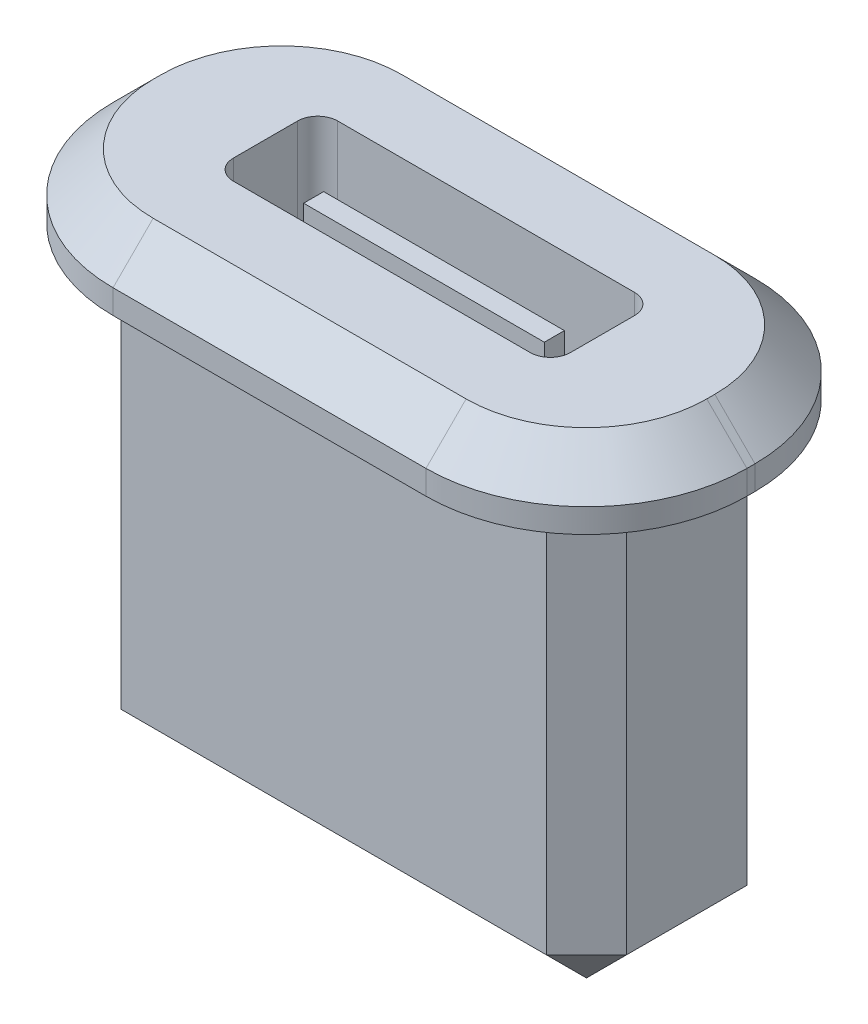
from build123d import *

# Parameters (mm, degrees)
BOSS_EXTRUDE1_DEPTH = 1.6
CHAMFER1_SIZE       = 1
SKETCH3_W           = 12.6
SKETCH3_H           = 5
BOSS_EXTRUDE2_DEPTH = 11
CHAMFER2_SIZE       = 1
CUT_EXTRUDE1_DEPTH  = 6.65
SKETCH4_W           = 6
SKETCH4_H           = 0.5
BOSS_EXTRUDE3_DEPTH = 6


with BuildPart() as part:
    # Sketch1 → Boss-Extrude1 (new body)
    with BuildSketch(Plane(origin=(0, 0, 0), x_dir=(1, 0, 0), z_dir=(0, 1, 0))):
        with BuildLine():
            Line((-3.9, -4.1), (3.9, -4.1))
            ThreePointArc((3.9, -4.1), (6.728427125, -2.928427125), (7.9, -0.1))
            Line((7.9, -0.1), (7.9, 0.1))
            ThreePointArc((7.9, 0.1), (6.728427125, 2.928427125), (3.9, 4.1))
            Line((3.9, 4.1), (-3.9, 4.1))
            ThreePointArc((-3.9, 4.1), (-6.728427125, 2.928427125), (-7.9, 0.1))
            Line((-7.9, 0.1), (-7.9, -0.1))
            ThreePointArc((-7.9, -0.1), (-6.728427125, -2.928427125), (-3.9, -4.1))
        make_face()
    extrude(amount=BOSS_EXTRUDE1_DEPTH)

    # Chamfer1
    chamfer1_edges = [part.edges().sort_by_distance(p)[0] for p in [
        (0, 1.6, -4.1),
        (-6.728427125, 1.6, -2.928427125),
        (6.728427125, 1.6, -2.928427125),
        (-7.9, 1.6, 0),
        (7.9, 1.6, 0),
        (-6.728427125, 1.6, 2.928427125),
        (6.728427125, 1.6, 2.928427125),
        (0, 1.6, 4.1),
    ]]
    chamfer(chamfer1_edges, length=CHAMFER1_SIZE)

    # Sketch3 → Boss-Extrude2 (add)
    with BuildSketch(Plane.XZ):
        Rectangle(SKETCH3_W, SKETCH3_H)
    extrude(amount=BOSS_EXTRUDE2_DEPTH)

    # Chamfer2
    chamfer2_edges = [part.edges().sort_by_distance(p)[0] for p in [
        (-6.3, -11, 0),
        (-6.3, -5.5, 2.5),
        (6.3, -5.5, 2.5),
        (0, -11, 2.5),
        (6.3, -11, 0),
        (6.3, -5.5, -2.5),
        (0, -11, -2.5),
        (-6.3, -5.5, -2.5),
    ]]
    chamfer(chamfer2_edges, length=CHAMFER2_SIZE)

    # Sketch2 → Cut-Extrude1 (cut)
    with BuildSketch(Plane(origin=(0, 1.6, 0), x_dir=(1, 0, 0), z_dir=(0, 1, 0))):
        with BuildLine():
            Line((-3.7, -1.3), (3.7, -1.3))
            ThreePointArc((3.7, -1.3), (4.053553391, -1.153553391), (4.2, -0.8))
            Line((4.2, -0.8), (4.2, 0.8))
            ThreePointArc((4.2, 0.8), (4.053553391, 1.153553391), (3.7, 1.3))
            Line((3.7, 1.3), (-3.7, 1.3))
            ThreePointArc((-3.7, 1.3), (-4.053553391, 1.153553391), (-4.2, 0.8))
            Line((-4.2, 0.8), (-4.2, -0.8))
            ThreePointArc((-4.2, -0.8), (-4.053553391, -1.153553391), (-3.7, -1.3))
        make_face()
    extrude(amount=-CUT_EXTRUDE1_DEPTH, mode=Mode.SUBTRACT)

    # Sketch4 → Boss-Extrude3 (add)
    with BuildSketch(Plane(origin=(0, -5.05, 0), x_dir=(1, 0, 0), z_dir=(0, 1, 0))):
        Rectangle(SKETCH4_W, SKETCH4_H)
    extrude(amount=BOSS_EXTRUDE3_DEPTH)


solid = part.part
